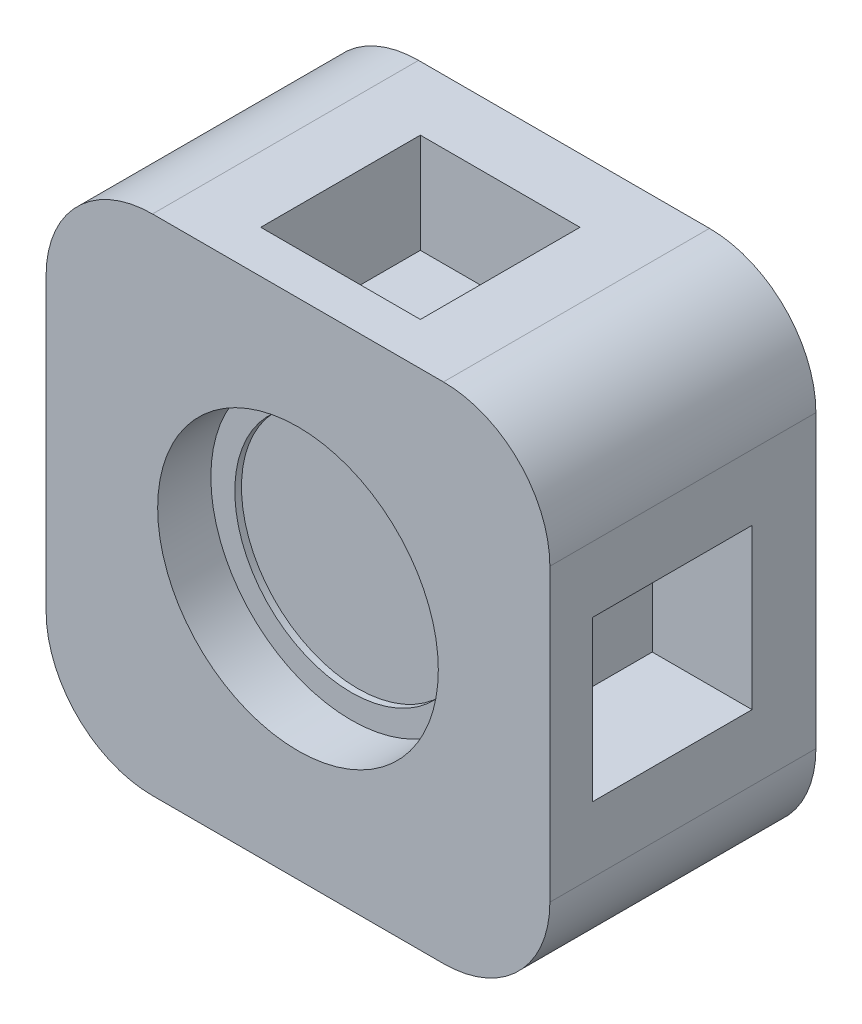
from build123d import *

# Parameters (mm, degrees)
SKIZZE1_W                          = 37.873435046
SKIZZE1_H                          = 37.873435047
AUFSATZ_LINEAR_AUSTRAGEN1_DEPTH    = 20
SKIZZE2_R                          = 10.55
SCHNITT_LINEAR_AUSTRAGEN1_DEPTH    = 4
SKIZZE3_W                          = 12
SKIZZE3_H                          = 12
SCHNITT_LINEAR_AUSTRAGEN3_DEPTH    = 7.5
VERRUNDUNG1_R                      = 8
KREISMUSTER1_COUNT                 = 4
SKIZZE4_R                          = 8.75
SCHNITT_LINEAR_AUSTRAGEN4_DEPTH    = 0.5
K_RPER_VERSCHIEBEN_KOPIEREN1_ANGLE = 90


with BuildPart() as part:
    # Skizze1 → Aufsatz-Linear austragen1 (new body)
    with BuildSketch(Plane(origin=(0, 0, 0), x_dir=(1, 0, 0), z_dir=(0, 1, 0))):
        with Locations((6, 12.936717524)):
            Rectangle(SKIZZE1_W, SKIZZE1_H)
    extrude(amount=AUFSATZ_LINEAR_AUSTRAGEN1_DEPTH)

    # Skizze2 → Schnitt-Linear austragen1 (cut)
    with BuildSketch(Plane.XZ):
        with Locations(Location((6, -12.936717523, 0), (0, 0, 270))):
            Circle(SKIZZE2_R)
    extrude(amount=-SCHNITT_LINEAR_AUSTRAGEN1_DEPTH, mode=Mode.SUBTRACT)

    # Skizze3 → Schnitt-Linear austragen3 (cut)
    with BuildSketch(Plane.XY.offset(6)):
        with Locations((6, 9.2)):
            Rectangle(SKIZZE3_W, SKIZZE3_H)
    schnitt_linear_austragen3 = extrude(amount=-SCHNITT_LINEAR_AUSTRAGEN3_DEPTH, mode=Mode.SUBTRACT)

    # Verrundung1
    verrundung1_edges = [part.edges().sort_by_distance(p)[0] for p in [
        (24.936717523, 10, -31.873435047),
        (24.936717523, 10, 6),
        (-12.936717523, 10, 6),
        (-12.936717523, 10, -31.873435047),
    ]]
    fillet(verrundung1_edges, radius=VERRUNDUNG1_R)

    # Kreismuster1: Schnitt-Linear austragen3 ×4 about axis
    kreismuster1_axis = Axis((6, 0, -12.936717523), (0, 1, 0))
    for i in range(1, KREISMUSTER1_COUNT):
        add(schnitt_linear_austragen3.rotate(kreismuster1_axis, i * 360 / KREISMUSTER1_COUNT), mode=Mode.SUBTRACT)

    # Skizze4 → Schnitt-Linear austragen4 (cut)
    with BuildSketch(Plane.XZ.offset(-4)):
        with Locations(Location((6, -12.936717523, 0), (0, 0, 270))):
            Circle(SKIZZE4_R)
    extrude(amount=-SCHNITT_LINEAR_AUSTRAGEN4_DEPTH, mode=Mode.SUBTRACT)


with BuildPart() as part_1:
    # Körper-Verschieben/Kopieren1: moved
    add(part.part.rotate(Axis((0, 10, -12.936717523), (-1, 0, 0)), K_RPER_VERSCHIEBEN_KOPIEREN1_ANGLE))


solid = part_1.part
